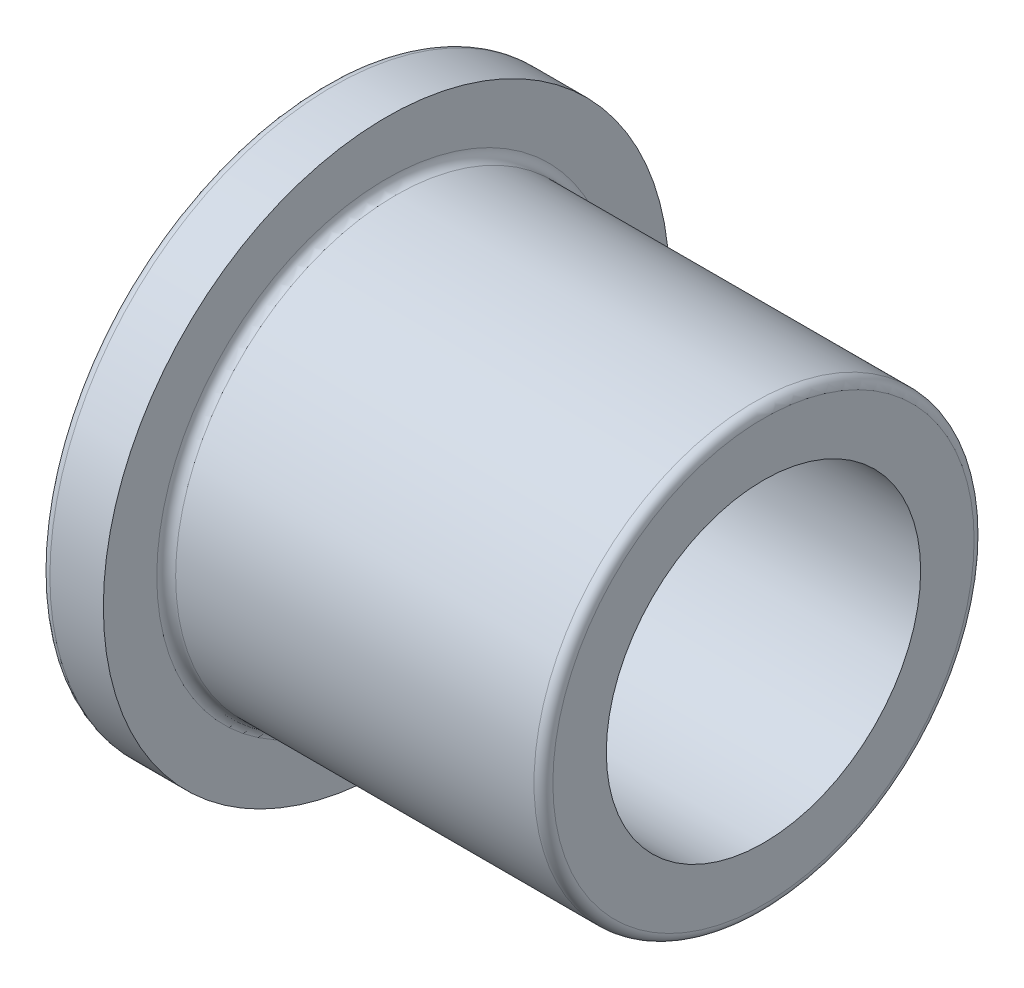
from build123d import *

# Parameters (mm, degrees)
SKETCH1_R           = 7
SKETCH1_R_2         = 5
BOSS_EXTRUDE1_DEPTH = 12
SKETCH2_R           = 9
SKETCH2_R_2         = 5
BOSS_EXTRUDE2_DEPTH = 2
FILLET1_R           = 0.3


with BuildPart() as part:
    # Sketch1 → Boss-Extrude1 (new body)
    with BuildSketch(Plane(origin=(0, 0, 0), x_dir=(0, 0, -1), z_dir=(1, 0, 0))):
        Circle(SKETCH1_R)
        Circle(SKETCH1_R_2, mode=Mode.SUBTRACT)
    extrude(amount=-BOSS_EXTRUDE1_DEPTH)

    # Sketch2 → Boss-Extrude2 (add)
    with BuildSketch(Plane.ZY.offset(12)):
        Circle(SKETCH2_R)
        with Locations(Location((0, 0, 0), (0, 0, 180))):
            Circle(SKETCH2_R_2, mode=Mode.SUBTRACT)
    extrude(amount=BOSS_EXTRUDE2_DEPTH)

    # Fillet1
    fillet1_edges = [part.edges().sort_by_distance(p)[0] for p in [
        (-12, 0, 7),
        (-14, 0, -9),
        (0, 0, 7),
    ]]
    fillet(fillet1_edges, radius=FILLET1_R)


solid = part.part
